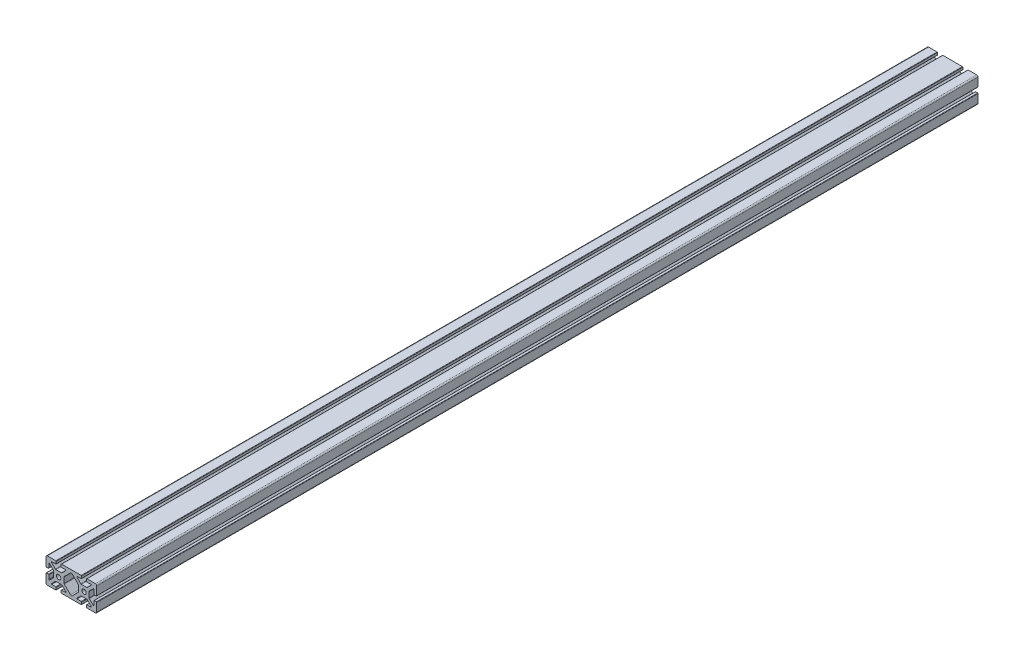
from build123d import *

# Parameters (mm, degrees)
SKETCH1_R           = 3.5
BOSS_EXTRUDE1_DEPTH = 695.03


with BuildPart() as part:
    # Sketch1 → Boss-Extrude1 (new, symmetric)
    with BuildSketch(Plane.XY):
        with BuildLine():
            Line((-30.9, 15.517871555), (-24.6, 15.517871555))
            ThreePointArc((-24.6, 15.517871555), (-24.175735931, 15.693607486), (-24, 16.117871555))
            Line((-24, 16.117871555), (-24, 19.4))
            ThreePointArc((-24, 19.4), (-24.175735931, 19.824264069), (-24.6, 20))
            Line((-24.6, 20), (-37.9, 20))
            ThreePointArc((-37.9, 20), (-39.38492424, 19.38492424), (-40, 17.9))
            Line((-40, 17.9), (-40, 4.6))
            ThreePointArc((-40, 4.6), (-39.824264069, 4.175735931), (-39.4, 4))
            Line((-39.4, 4), (-36.117871555, 4))
            ThreePointArc((-36.117871555, 4), (-35.693607486, 4.175735931), (-35.517871555, 4.6))
            Line((-35.517871555, 4.6), (-35.517871555, 10.9))
            ThreePointArc((-35.517871555, 10.9), (-35.147481614, 11.45432772), (-34.493607486, 11.324264069))
            Line((-34.493607486, 11.324264069), (-28.351471863, 5.182128445))
            ThreePointArc((-28.351471863, 5.182128445), (-28.091344561, 4.792820426), (-28, 4.333600308))
            Line((-28, 4.333600308), (-28, -4.333600308))
            ThreePointArc((-28, -4.333600308), (-28.091344561, -4.792820426), (-28.351471863, -5.182128445))
            Line((-28.351471863, -5.182128445), (-34.493607486, -11.324264069))
            ThreePointArc((-34.493607486, -11.324264069), (-35.147481614, -11.45432772), (-35.517871555, -10.9))
            Line((-35.517871555, -10.9), (-35.517871555, -4.6))
            ThreePointArc((-35.517871555, -4.6), (-35.693607486, -4.175735931), (-36.117871555, -4))
            Line((-36.117871555, -4), (-39.4, -4))
            ThreePointArc((-39.4, -4), (-39.824264069, -4.175735931), (-40, -4.6))
            Line((-40, -4.6), (-40, -17.9))
            ThreePointArc((-40, -17.9), (-39.38492424, -19.38492424), (-37.9, -20))
            Line((-37.9, -20), (-24.6, -20))
            ThreePointArc((-24.6, -20), (-24.175735931, -19.824264069), (-24, -19.4))
            Line((-24, -19.4), (-24, -16.117871555))
            ThreePointArc((-24, -16.117871555), (-24.175735931, -15.693607486), (-24.6, -15.517871555))
            Line((-24.6, -15.517871555), (-30.9, -15.517871555))
            ThreePointArc((-30.9, -15.517871555), (-31.45432772, -15.147481614), (-31.324264069, -14.493607486))
            Line((-31.324264069, -14.493607486), (-25.182128445, -8.351471863))
            ThreePointArc((-25.182128445, -8.351471863), (-24.792820426, -8.091344561), (-24.333600308, -8))
            Line((-24.333600308, -8), (-15.666399692, -8))
            ThreePointArc((-15.666399692, -8), (-15.207179574, -8.091344561), (-14.817871555, -8.351471863))
            Line((-14.817871555, -8.351471863), (-8.675735931, -14.493607486))
            ThreePointArc((-8.675735931, -14.493607486), (-8.54567228, -15.147481614), (-9.1, -15.517871555))
            Line((-9.1, -15.517871555), (-15.4, -15.517871555))
            ThreePointArc((-15.4, -15.517871555), (-15.824264069, -15.693607486), (-16, -16.117871555))
            Line((-16, -16.117871555), (-16, -19.4))
            ThreePointArc((-16, -19.4), (-15.824264069, -19.824264069), (-15.4, -20))
            Line((-15.4, -20), (15.4, -20))
            ThreePointArc((15.4, -20), (15.824264069, -19.824264069), (16, -19.4))
            Line((16, -19.4), (16, -16.117871555))
            ThreePointArc((16, -16.117871555), (15.824264069, -15.693607486), (15.4, -15.517871555))
            Line((15.4, -15.517871555), (9.1, -15.517871555))
            ThreePointArc((9.1, -15.517871555), (8.54567228, -15.147481614), (8.675735931, -14.493607486))
            Line((8.675735931, -14.493607486), (14.817871555, -8.351471863))
            ThreePointArc((14.817871555, -8.351471863), (15.207179574, -8.091344561), (15.666399692, -8))
            Line((15.666399692, -8), (24.333600308, -8))
            ThreePointArc((24.333600308, -8), (24.792820426, -8.091344561), (25.182128445, -8.351471863))
            Line((25.182128445, -8.351471863), (31.324264069, -14.493607486))
            ThreePointArc((31.324264069, -14.493607486), (31.45432772, -15.147481614), (30.9, -15.517871555))
            Line((30.9, -15.517871555), (24.6, -15.517871555))
            ThreePointArc((24.6, -15.517871555), (24.175735931, -15.693607486), (24, -16.117871555))
            Line((24, -16.117871555), (24, -19.4))
            ThreePointArc((24, -19.4), (24.175735931, -19.824264069), (24.6, -20))
            Line((24.6, -20), (37.9, -20))
            ThreePointArc((37.9, -20), (39.38492424, -19.38492424), (40, -17.9))
            Line((40, -17.9), (40, -4.6))
            ThreePointArc((40, -4.6), (39.824264069, -4.175735931), (39.4, -4))
            Line((39.4, -4), (36.117871555, -4))
            ThreePointArc((36.117871555, -4), (35.693607486, -4.175735931), (35.517871555, -4.6))
            Line((35.517871555, -4.6), (35.517871555, -10.9))
            ThreePointArc((35.517871555, -10.9), (35.147481614, -11.45432772), (34.493607486, -11.324264069))
            Line((34.493607486, -11.324264069), (28.351471863, -5.182128445))
            ThreePointArc((28.351471863, -5.182128445), (28.091344561, -4.792820426), (28, -4.333600308))
            Line((28, -4.333600308), (28, 4.333600308))
            ThreePointArc((28, 4.333600308), (28.091344561, 4.792820426), (28.351471863, 5.182128445))
            Line((28.351471863, 5.182128445), (34.493607486, 11.324264069))
            ThreePointArc((34.493607486, 11.324264069), (35.147481614, 11.45432772), (35.517871555, 10.9))
            Line((35.517871555, 10.9), (35.517871555, 4.6))
            ThreePointArc((35.517871555, 4.6), (35.693607486, 4.175735931), (36.117871555, 4))
            Line((36.117871555, 4), (39.4, 4))
            ThreePointArc((39.4, 4), (39.824264069, 4.175735931), (40, 4.6))
            Line((40, 4.6), (40, 17.9))
            ThreePointArc((40, 17.9), (39.38492424, 19.38492424), (37.9, 20))
            Line((37.9, 20), (24.6, 20))
            ThreePointArc((24.6, 20), (24.175735931, 19.824264069), (24, 19.4))
            Line((24, 19.4), (24, 16.117871555))
            ThreePointArc((24, 16.117871555), (24.175735931, 15.693607486), (24.6, 15.517871555))
            Line((24.6, 15.517871555), (30.9, 15.517871555))
            ThreePointArc((30.9, 15.517871555), (31.45432772, 15.147481614), (31.324264069, 14.493607486))
            Line((31.324264069, 14.493607486), (25.182128445, 8.351471863))
            ThreePointArc((25.182128445, 8.351471863), (24.792820426, 8.091344561), (24.333600308, 8))
            Line((24.333600308, 8), (15.666399692, 8))
            ThreePointArc((15.666399692, 8), (15.207179574, 8.091344561), (14.817871555, 8.351471863))
            Line((14.817871555, 8.351471863), (8.675735931, 14.493607486))
            ThreePointArc((8.675735931, 14.493607486), (8.54567228, 15.147481614), (9.1, 15.517871555))
            Line((9.1, 15.517871555), (15.4, 15.517871555))
            ThreePointArc((15.4, 15.517871555), (15.824264069, 15.693607486), (16, 16.117871555))
            Line((16, 16.117871555), (16, 19.4))
            ThreePointArc((16, 19.4), (15.824264069, 19.824264069), (15.4, 20))
            Line((15.4, 20), (-15.4, 20))
            ThreePointArc((-15.4, 20), (-15.824264069, 19.824264069), (-16, 19.4))
            Line((-16, 19.4), (-16, 16.117871555))
            ThreePointArc((-16, 16.117871555), (-15.824264069, 15.693607486), (-15.4, 15.517871555))
            Line((-15.4, 15.517871555), (-9.1, 15.517871555))
            ThreePointArc((-9.1, 15.517871555), (-8.54567228, 15.147481614), (-8.675735931, 14.493607486))
            Line((-8.675735931, 14.493607486), (-14.817871555, 8.351471863))
            ThreePointArc((-14.817871555, 8.351471863), (-15.207179574, 8.091344561), (-15.666399692, 8))
            Line((-15.666399692, 8), (-24.333600308, 8))
            ThreePointArc((-24.333600308, 8), (-24.792820426, 8.091344561), (-25.182128445, 8.351471863))
            Line((-25.182128445, 8.351471863), (-31.324264069, 14.493607486))
            ThreePointArc((-31.324264069, 14.493607486), (-31.45432772, 15.147481614), (-30.9, 15.517871555))
        make_face()
        with Locations((20, 0)):
            Circle(SKETCH1_R, mode=Mode.SUBTRACT)
        with Locations((-20, 0)):
            Circle(SKETCH1_R, mode=Mode.SUBTRACT)
        with BuildLine():
            Line((11.205591591, -5.182128445), (1.48492424, -14.902795796))
            ThreePointArc((1.48492424, -14.902795796), (0, -15.517871555), (-1.48492424, -14.902795796))
            Line((-1.48492424, -14.902795796), (-11.205591591, -5.182128445))
            ThreePointArc((-11.205591591, -5.182128445), (-11.465718893, -4.792820426), (-11.557063454, -4.333600308))
            Line((-11.557063454, -4.333600308), (-11.557063454, 4.333600308))
            ThreePointArc((-11.557063454, 4.333600308), (-11.465718893, 4.792820426), (-11.205591591, 5.182128445))
            Line((-11.205591591, 5.182128445), (-1.48492424, 14.902795796))
            ThreePointArc((-1.48492424, 14.902795796), (0, 15.517871555), (1.48492424, 14.902795796))
            Line((1.48492424, 14.902795796), (11.205591591, 5.182128445))
            ThreePointArc((11.205591591, 5.182128445), (11.465718893, 4.792820426), (11.557063454, 4.333600308))
            Line((11.557063454, 4.333600308), (11.557063454, -4.333600308))
            ThreePointArc((11.557063454, -4.333600308), (11.465718893, -4.792820426), (11.205591591, -5.182128445))
        make_face(mode=Mode.SUBTRACT)
    extrude(amount=BOSS_EXTRUDE1_DEPTH, both=True)


solid = part.part
